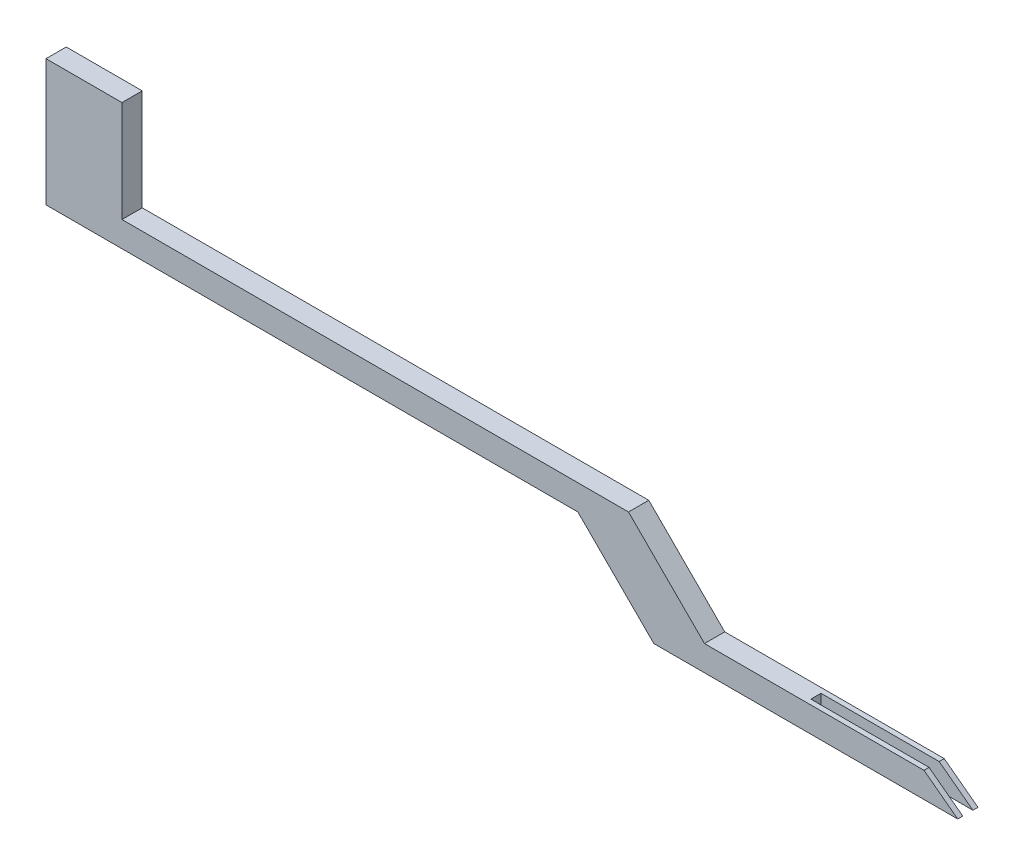
from build123d import *

# Parameters (mm, degrees)
BOSS_EXTRUDE1_DEPTH = 0.4
SKETCH5_W           = 3
SKETCH5_H           = 0.2
CUT_EXTRUDE1_DEPTH  = 0.7


with BuildPart() as part:
    # Sketch3 → Boss-Extrude1 (new body)
    with BuildSketch(Plane.XY):
        Polygon((0, 0), (0, 2.5), (1.5, 2.5), (1.5, 0.5), (11.5, 0.5), (13, -1), (17.333333334, -1), (18, -1.5), (12, -1.5), (10.5, 0), align=None)
    extrude(amount=BOSS_EXTRUDE1_DEPTH)

    # Sketch5 → Cut-Extrude1 (cut)
    with BuildSketch(Plane(origin=(0, -1, 0), x_dir=(1, 0, 0), z_dir=(0, 1, 0))):
        with Locations((16.5, -0.2)):
            Rectangle(SKETCH5_W, SKETCH5_H)
    extrude(amount=-CUT_EXTRUDE1_DEPTH, mode=Mode.SUBTRACT)


solid = part.part
